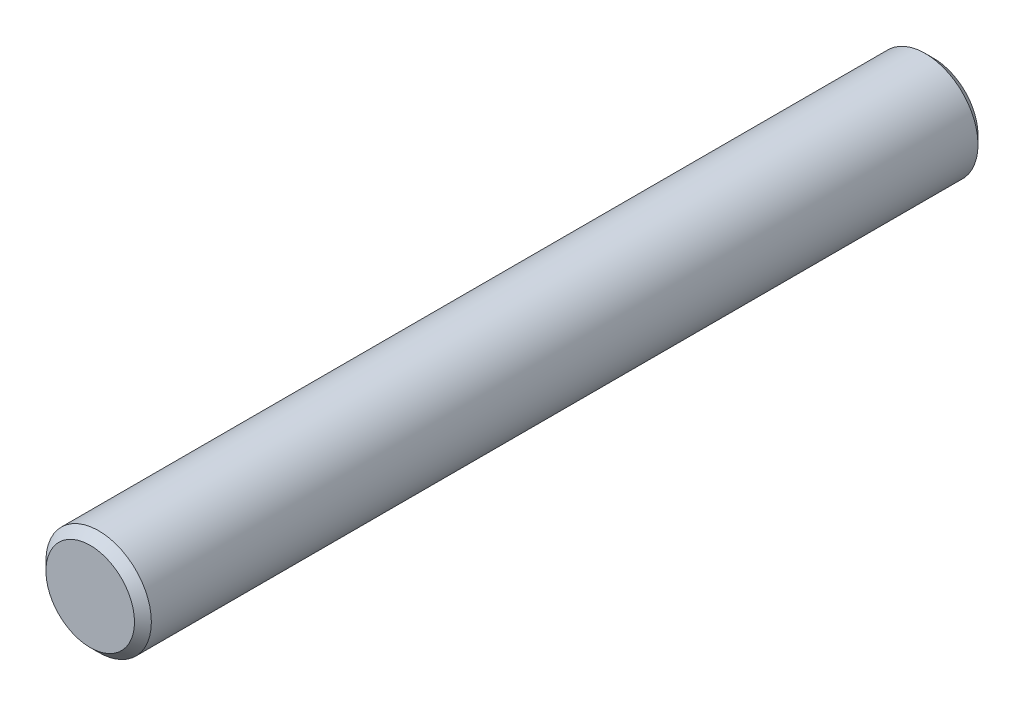
from build123d import *

# Parameters (mm, degrees)
SKETCH1_R           = 12.5
BOSS_EXTRUDE1_DEPTH = 200
CHAMFER1_SIZE       = 2
CHAMFER2_SIZE       = 2


with BuildPart() as part:
    # Sketch1 → Boss-Extrude1 (new body)
    with BuildSketch(Plane.XY):
        Circle(SKETCH1_R)
    extrude(amount=BOSS_EXTRUDE1_DEPTH)

    # Chamfer1
    chamfer1_edges = [part.edges().sort_by_distance(p)[0] for p in [
        (-12.5, 0, 0),
    ]]
    chamfer(chamfer1_edges, length=CHAMFER1_SIZE)

    # Chamfer2
    chamfer2_edges = [part.edges().sort_by_distance(p)[0] for p in [
        (-12.5, 0, 200),
    ]]
    chamfer(chamfer2_edges, length=CHAMFER2_SIZE)


solid = part.part
